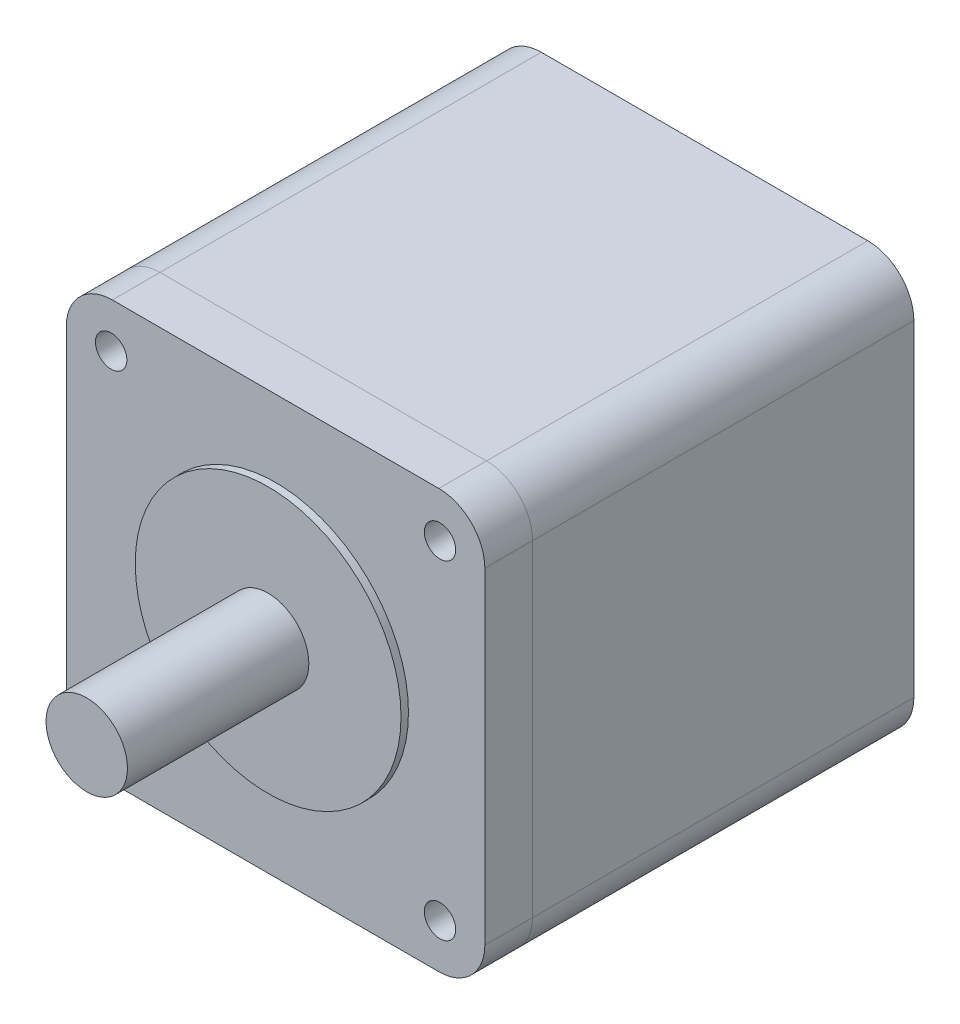
from build123d import *

# Parameters (mm, degrees)
EXTRUDE_1_DEPTH     = 20.5
CUT_EXTRUDE_1_REACH = 130.92
SKETCH_2_R          = 6.75
EXTRUDE_2_DEPTH     = 164
SKETCH_4_R          = 57.15
EXTRUDE_3_DEPTH     = 3.2
SKETCH_5_R          = 17.5
EXTRUDE_4_DEPTH     = 78


with BuildPart() as part:
    # 草图1 → 凸台-拉伸1 (new body)
    with BuildSketch(Plane.XY):
        with BuildLine():
            Line((-70.206004001, -90), (70.206004001, -90))
            ThreePointArc((70.206004001, -90), (84.202472799, -84.202472799), (90, -70.206004001))
            Line((90, -70.206004001), (90, 70.206004001))
            ThreePointArc((90, 70.206004001), (84.202472799, 84.202472799), (70.206004001, 90))
            Line((70.206004001, 90), (-70.206004001, 90))
            ThreePointArc((-70.206004001, 90), (-84.202472799, 84.202472799), (-90, 70.206004001))
            Line((-90, 70.206004001), (-90, -70.206004001))
            ThreePointArc((-90, -70.206004001), (-84.202472799, -84.202472799), (-70.206004001, -90))
        make_face()
    extrude(amount=EXTRUDE_1_DEPTH)

    # 草图2 → 切除-拉伸1 (cut, up to next)
    with BuildSketch(Plane.XY.offset(20.5), mode=Mode.PRIVATE) as cut_extrude_1_sk1:
        with Locations((-70.7107, 70.7107)):
            Circle(SKETCH_2_R)
    cut_extrude_1_tool1 = extrude(cut_extrude_1_sk1.sketch, amount=-CUT_EXTRUDE_1_REACH, mode=Mode.PRIVATE) & part.part
    # 草图2 → 切除-拉伸1 (cut, up to next)
    with BuildSketch(Plane.XY.offset(20.5), mode=Mode.PRIVATE) as cut_extrude_1_sk2:
        with Locations((70.7107, 70.7107)):
            Circle(SKETCH_2_R)
    cut_extrude_1_tool2 = extrude(cut_extrude_1_sk2.sketch, amount=-CUT_EXTRUDE_1_REACH, mode=Mode.PRIVATE) & part.part
    # 草图2 → 切除-拉伸1 (cut, up to next)
    with BuildSketch(Plane.XY.offset(20.5), mode=Mode.PRIVATE) as cut_extrude_1_sk3:
        with Locations((70.7107, -70.7107)):
            Circle(SKETCH_2_R)
    cut_extrude_1_tool3 = extrude(cut_extrude_1_sk3.sketch, amount=-CUT_EXTRUDE_1_REACH, mode=Mode.PRIVATE) & part.part
    # 草图2 → 切除-拉伸1 (cut, up to next)
    with BuildSketch(Plane.XY.offset(20.5), mode=Mode.PRIVATE) as cut_extrude_1_sk4:
        with Locations((-70.7107, -70.7107)):
            Circle(SKETCH_2_R)
    cut_extrude_1_tool4 = extrude(cut_extrude_1_sk4.sketch, amount=-CUT_EXTRUDE_1_REACH, mode=Mode.PRIVATE) & part.part
    add(cut_extrude_1_tool1.solids().sort_by_distance((-70.7107, 70.7107, 20.5))[0], mode=Mode.SUBTRACT)
    add(cut_extrude_1_tool2.solids().sort_by_distance((70.7107, 70.7107, 20.5))[0], mode=Mode.SUBTRACT)
    add(cut_extrude_1_tool3.solids().sort_by_distance((70.7107, -70.7107, 20.5))[0], mode=Mode.SUBTRACT)
    add(cut_extrude_1_tool4.solids().sort_by_distance((-70.7107, -70.7107, 20.5))[0], mode=Mode.SUBTRACT)

    # 草图4 → 凸台-拉伸3 (add)
    with BuildSketch(Plane.XY.offset(20.5)):
        with Locations(Location((0, 0, 0), (0, 0, 180))):
            Circle(SKETCH_4_R)
    extrude(amount=EXTRUDE_3_DEPTH)

    # 草图5 → 凸台-拉伸4 (add)
    with BuildSketch(Plane.XY.offset(23.7)):
        Circle(SKETCH_5_R)
    extrude(amount=EXTRUDE_4_DEPTH)


with BuildPart() as body_2:
    # 草图3 → 凸台-拉伸2 (new body)
    with BuildSketch(Plane(origin=(0, 0, 0), x_dir=(-1, 0, 0), z_dir=(0, 0, -1))):
        with BuildLine():
            Line((-70.206004001, -90), (70.206004001, -90))
            ThreePointArc((70.206004001, -90), (84.202472799, -84.202472799), (90, -70.206004001))
            Line((90, -70.206004001), (90, 70.206004001))
            ThreePointArc((90, 70.206004001), (84.202472799, 84.202472799), (70.206004001, 90))
            Line((70.206004001, 90), (-70.206004001, 90))
            ThreePointArc((-70.206004001, 90), (-84.202472799, 84.202472799), (-90, 70.206004001))
            Line((-90, 70.206004001), (-90, -70.206004001))
            ThreePointArc((-90, -70.206004001), (-84.202472799, -84.202472799), (-70.206004001, -90))
        make_face()
    extrude(amount=EXTRUDE_2_DEPTH)


solid = Compound([part.part, body_2.part])
